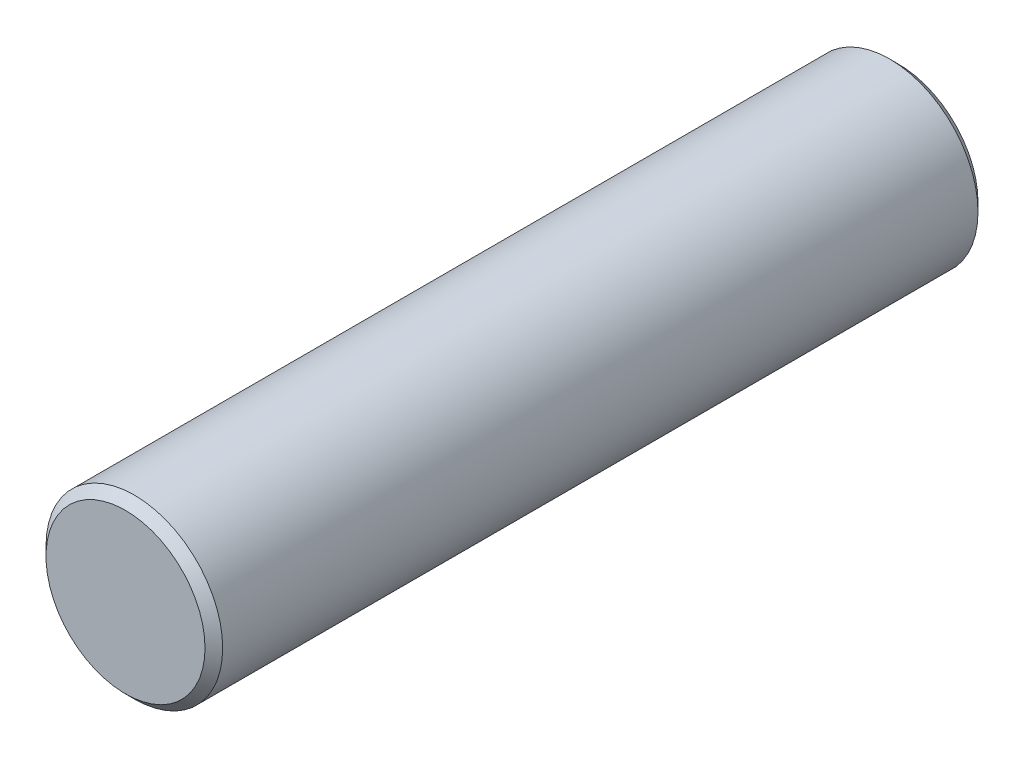
from build123d import *

# Parameters (mm, degrees)
SKETCH1_R      = 20
EXTRUDE1_DEPTH = 175
CHAMFER1_SIZE  = 2


with BuildPart() as part:
    # Sketch1 → Extrude1 (new body)
    with BuildSketch(Plane.XY):
        Circle(SKETCH1_R)
    extrude(amount=EXTRUDE1_DEPTH)

    # Chamfer1
    chamfer1_edges = [part.edges().sort_by_distance(p)[0] for p in [
        (-20, 0, 0),
        (-20, 0, 175),
    ]]
    chamfer(chamfer1_edges, length=CHAMFER1_SIZE)


solid = part.part
